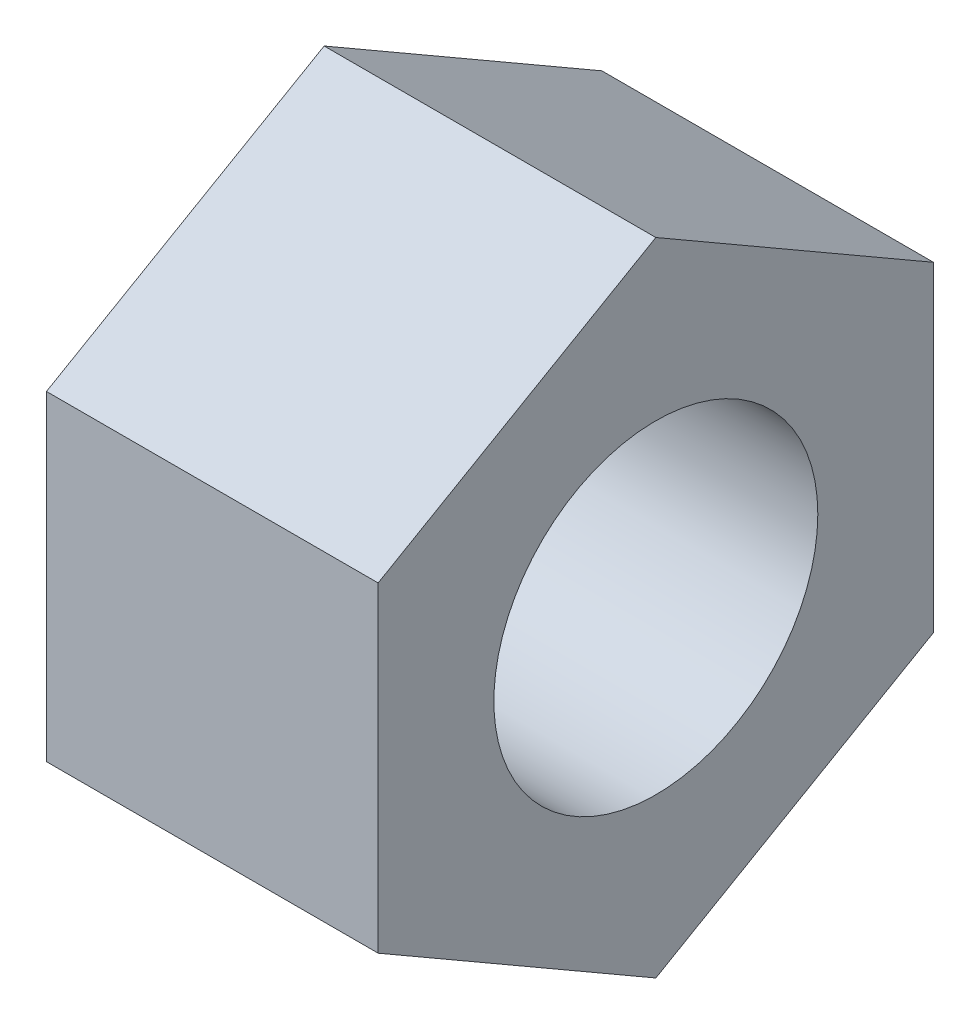
from build123d import *

# Parameters (mm, degrees)
BASENUTSKETCH_R = 10.5
BASENUT_DEPTH   = 21.5


with BuildPart() as part:
    # BaseNutSketch → BaseNut (new body)
    with BuildSketch(Plane(origin=(0, 0, 0), x_dir=(0, -1, 0), z_dir=(1, 0, 0))):
        Polygon((10.392304845, 18), (-10.392304845, 18), (-20.784609691, 0), (-10.392304845, -18), (10.392304845, -18), (20.784609691, 0), align=None)
        with Locations(Location((0, 0, 0), (0, 0, 90))):
            Circle(BASENUTSKETCH_R, mode=Mode.SUBTRACT)
    extrude(amount=BASENUT_DEPTH)


solid = part.part
